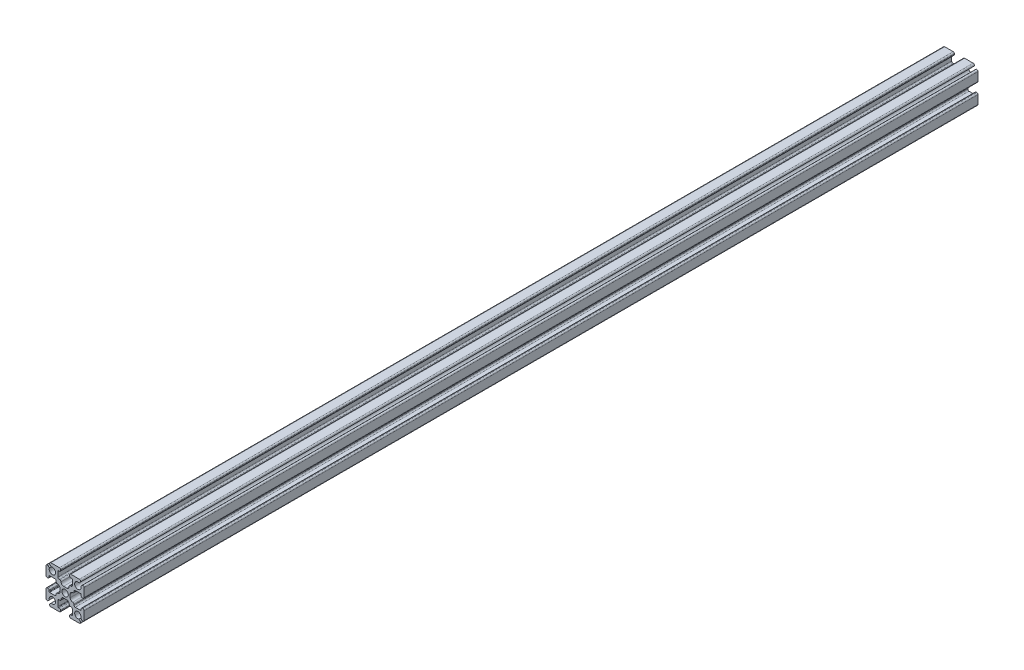
from build123d import *

# Parameters (mm, degrees)
SKETCH1_R           = 1.25
BOSS_EXTRUDE1_DEPTH = 351.000000056


with BuildPart() as part:
    # Sketch1 → Boss-Extrude1 (new body)
    with BuildSketch(Plane.XY):
        with BuildLine():
            Line((6.646446609, 5.939339828), (6.163645978, 5.456539197))
            ThreePointArc((6.163645978, 5.456539197), (4.116116524, 4.116116524), (5.456539197, 6.163645978))
            Line((5.456539197, 6.163645978), (5.939339828, 6.646446609))
            ThreePointArc((5.939339828, 6.646446609), (6.047726204, 7.191341716), (5.585786438, 7.5))
            Line((5.585786438, 7.5), (2.25, 7.5))
            ThreePointArc((2.25, 7.5), (1.896446609, 7.353553391), (1.75, 7))
            Line((1.75, 7), (1.75, 6.8))
            ThreePointArc((1.75, 6.8), (1.896446609, 6.446446609), (2.25, 6.3))
            Line((2.25, 6.3), (2.65, 6.3))
            ThreePointArc((2.65, 6.3), (2.791421356, 6.241421356), (2.85, 6.1))
            Line((2.85, 6.1), (2.85, 4))
            ThreePointArc((2.85, 4), (2.703553391, 3.646446609), (2.35, 3.5))
            Line((2.35, 3.5), (2.1, 3.5))
            ThreePointArc((2.1, 3.5), (1.746446609, 3.353553391), (1.6, 3))
            ThreePointArc((1.6, 3), (1.307106781, 2.292893219), (0.6, 2))
            Line((0.6, 2), (-0.6, 2))
            ThreePointArc((-0.6, 2), (-1.307106781, 2.292893219), (-1.6, 3))
            ThreePointArc((-1.6, 3), (-1.746446609, 3.353553391), (-2.1, 3.5))
            Line((-2.1, 3.5), (-2.35, 3.5))
            ThreePointArc((-2.35, 3.5), (-2.703553391, 3.646446609), (-2.85, 4))
            Line((-2.85, 4), (-2.85, 6.1))
            ThreePointArc((-2.85, 6.1), (-2.791421356, 6.241421356), (-2.65, 6.3))
            Line((-2.65, 6.3), (-2.25, 6.3))
            ThreePointArc((-2.25, 6.3), (-1.896446609, 6.446446609), (-1.75, 6.8))
            Line((-1.75, 6.8), (-1.75, 7))
            ThreePointArc((-1.75, 7), (-1.896446609, 7.353553391), (-2.25, 7.5))
            Line((-2.25, 7.5), (-5.585786438, 7.5))
            ThreePointArc((-5.585786438, 7.5), (-6.047726204, 7.191341716), (-5.939339828, 6.646446609))
            Line((-5.939339828, 6.646446609), (-5.456539197, 6.163645978))
            ThreePointArc((-5.456539197, 6.163645978), (-4.116116524, 4.116116524), (-6.163645978, 5.456539197))
            Line((-6.163645978, 5.456539197), (-6.646446609, 5.939339828))
            ThreePointArc((-6.646446609, 5.939339828), (-7.191341716, 6.047726204), (-7.5, 5.585786438))
            Line((-7.5, 5.585786438), (-7.5, 2.25))
            ThreePointArc((-7.5, 2.25), (-7.353553391, 1.896446609), (-7, 1.75))
            Line((-7, 1.75), (-6.8, 1.75))
            ThreePointArc((-6.8, 1.75), (-6.446446609, 1.896446609), (-6.3, 2.25))
            Line((-6.3, 2.25), (-6.3, 2.65))
            ThreePointArc((-6.3, 2.65), (-6.241421356, 2.791421356), (-6.1, 2.85))
            Line((-6.1, 2.85), (-4, 2.85))
            ThreePointArc((-4, 2.85), (-3.646446609, 2.703553391), (-3.5, 2.35))
            Line((-3.5, 2.35), (-3.5, 2.1))
            ThreePointArc((-3.5, 2.1), (-3.353553391, 1.746446609), (-3, 1.6))
            ThreePointArc((-3, 1.6), (-2.292893219, 1.307106781), (-2, 0.6))
            Line((-2, 0.6), (-2, -0.6))
            ThreePointArc((-2, -0.6), (-2.292893219, -1.307106781), (-3, -1.6))
            ThreePointArc((-3, -1.6), (-3.353553391, -1.746446609), (-3.5, -2.1))
            Line((-3.5, -2.1), (-3.5, -2.35))
            ThreePointArc((-3.5, -2.35), (-3.646446609, -2.703553391), (-4, -2.85))
            Line((-4, -2.85), (-6.1, -2.85))
            ThreePointArc((-6.1, -2.85), (-6.241421356, -2.791421356), (-6.3, -2.65))
            Line((-6.3, -2.65), (-6.3, -2.25))
            ThreePointArc((-6.3, -2.25), (-6.446446609, -1.896446609), (-6.8, -1.75))
            Line((-6.8, -1.75), (-7, -1.75))
            ThreePointArc((-7, -1.75), (-7.353553391, -1.896446609), (-7.5, -2.25))
            Line((-7.5, -2.25), (-7.5, -5.585786438))
            ThreePointArc((-7.5, -5.585786438), (-7.191341716, -6.047726204), (-6.646446609, -5.939339828))
            Line((-6.646446609, -5.939339828), (-6.163645978, -5.456539197))
            ThreePointArc((-6.163645978, -5.456539197), (-4.116116524, -4.116116524), (-5.456539197, -6.163645978))
            Line((-5.456539197, -6.163645978), (-5.939339828, -6.646446609))
            ThreePointArc((-5.939339828, -6.646446609), (-6.047726204, -7.191341716), (-5.585786438, -7.5))
            Line((-5.585786438, -7.5), (-2.25, -7.5))
            ThreePointArc((-2.25, -7.5), (-1.896446609, -7.353553391), (-1.75, -7))
            Line((-1.75, -7), (-1.75, -6.8))
            ThreePointArc((-1.75, -6.8), (-1.896446609, -6.446446609), (-2.25, -6.3))
            Line((-2.25, -6.3), (-2.65, -6.3))
            ThreePointArc((-2.65, -6.3), (-2.791421356, -6.241421356), (-2.85, -6.1))
            Line((-2.85, -6.1), (-2.85, -4))
            ThreePointArc((-2.85, -4), (-2.703553391, -3.646446609), (-2.35, -3.5))
            Line((-2.35, -3.5), (-2.1, -3.5))
            ThreePointArc((-2.1, -3.5), (-1.746446609, -3.353553391), (-1.6, -3))
            ThreePointArc((-1.6, -3), (-1.307106781, -2.292893219), (-0.6, -2))
            Line((-0.6, -2), (0.6, -2))
            ThreePointArc((0.6, -2), (1.307106781, -2.292893219), (1.6, -3))
            ThreePointArc((1.6, -3), (1.746446609, -3.353553391), (2.1, -3.5))
            Line((2.1, -3.5), (2.35, -3.5))
            ThreePointArc((2.35, -3.5), (2.703553391, -3.646446609), (2.85, -4))
            Line((2.85, -4), (2.85, -6.1))
            ThreePointArc((2.85, -6.1), (2.791421356, -6.241421356), (2.65, -6.3))
            Line((2.65, -6.3), (2.25, -6.3))
            ThreePointArc((2.25, -6.3), (1.896446609, -6.446446609), (1.75, -6.8))
            Line((1.75, -6.8), (1.75, -7))
            ThreePointArc((1.75, -7), (1.896446609, -7.353553391), (2.25, -7.5))
            Line((2.25, -7.5), (5.585786438, -7.5))
            ThreePointArc((5.585786438, -7.5), (6.047726204, -7.191341716), (5.939339828, -6.646446609))
            Line((5.939339828, -6.646446609), (5.456539197, -6.163645978))
            ThreePointArc((5.456539197, -6.163645978), (4.116116524, -4.116116524), (6.163645978, -5.456539197))
            Line((6.163645978, -5.456539197), (6.646446609, -5.939339828))
            ThreePointArc((6.646446609, -5.939339828), (7.191341716, -6.047726204), (7.5, -5.585786438))
            Line((7.5, -5.585786438), (7.5, -2.25))
            ThreePointArc((7.5, -2.25), (7.353553391, -1.896446609), (7, -1.75))
            Line((7, -1.75), (6.8, -1.75))
            ThreePointArc((6.8, -1.75), (6.446446609, -1.896446609), (6.3, -2.25))
            Line((6.3, -2.25), (6.3, -2.65))
            ThreePointArc((6.3, -2.65), (6.241421356, -2.791421356), (6.1, -2.85))
            Line((6.1, -2.85), (4, -2.85))
            ThreePointArc((4, -2.85), (3.646446609, -2.703553391), (3.5, -2.35))
            Line((3.5, -2.35), (3.5, -2.1))
            ThreePointArc((3.5, -2.1), (3.353553391, -1.746446609), (3, -1.6))
            ThreePointArc((3, -1.6), (2.292893219, -1.307106781), (2, -0.6))
            Line((2, -0.6), (2, 0.6))
            ThreePointArc((2, 0.6), (2.292893219, 1.307106781), (3, 1.6))
            ThreePointArc((3, 1.6), (3.353553391, 1.746446609), (3.5, 2.1))
            Line((3.5, 2.1), (3.5, 2.35))
            ThreePointArc((3.5, 2.35), (3.646446609, 2.703553391), (4, 2.85))
            Line((4, 2.85), (6.1, 2.85))
            ThreePointArc((6.1, 2.85), (6.241421356, 2.791421356), (6.3, 2.65))
            Line((6.3, 2.65), (6.3, 2.25))
            ThreePointArc((6.3, 2.25), (6.446446609, 1.896446609), (6.8, 1.75))
            Line((6.8, 1.75), (7, 1.75))
            ThreePointArc((7, 1.75), (7.353553391, 1.896446609), (7.5, 2.25))
            Line((7.5, 2.25), (7.5, 5.585786438))
            ThreePointArc((7.5, 5.585786438), (7.191341716, 6.047726204), (6.646446609, 5.939339828))
        make_face()
        with Locations(Location((0, 0, 0), (0, 0, 180))):
            Circle(SKETCH1_R, mode=Mode.SUBTRACT)
    extrude(amount=BOSS_EXTRUDE1_DEPTH)


solid = part.part
